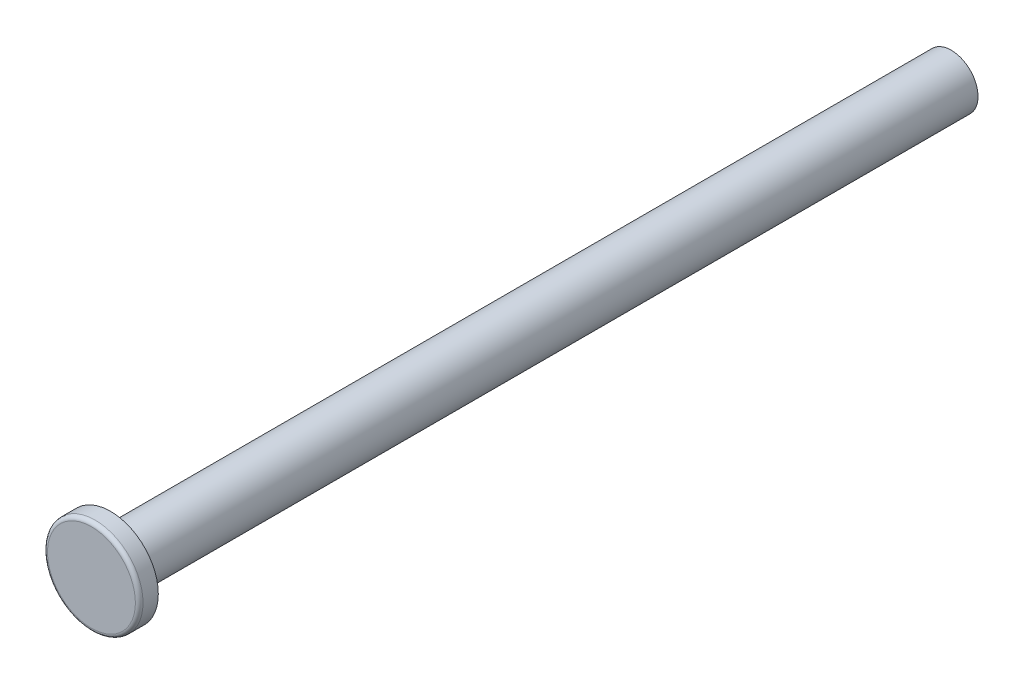
from build123d import *

# Parameters (mm, degrees)
SKETCH1_R           = 7
BOSS_EXTRUDE1_DEPTH = 110
SKETCH2_R           = 12.5
BOSS_EXTRUDE2_DEPTH = 5
FILLET1_R           = 1


with BuildPart() as part:
    # Sketch1 → Boss-Extrude1 (new, symmetric)
    with BuildSketch(Plane.XY):
        Circle(SKETCH1_R)
    extrude(amount=BOSS_EXTRUDE1_DEPTH, both=True)

    # Sketch2 → Boss-Extrude2 (add)
    with BuildSketch(Plane.XY.offset(110)):
        Circle(SKETCH2_R)
    extrude(amount=BOSS_EXTRUDE2_DEPTH)

    # Fillet1
    fillet1_edges = [part.edges().sort_by_distance(p)[0] for p in [
        (-12.5, 0, 115),
    ]]
    fillet(fillet1_edges, radius=FILLET1_R)


solid = part.part
